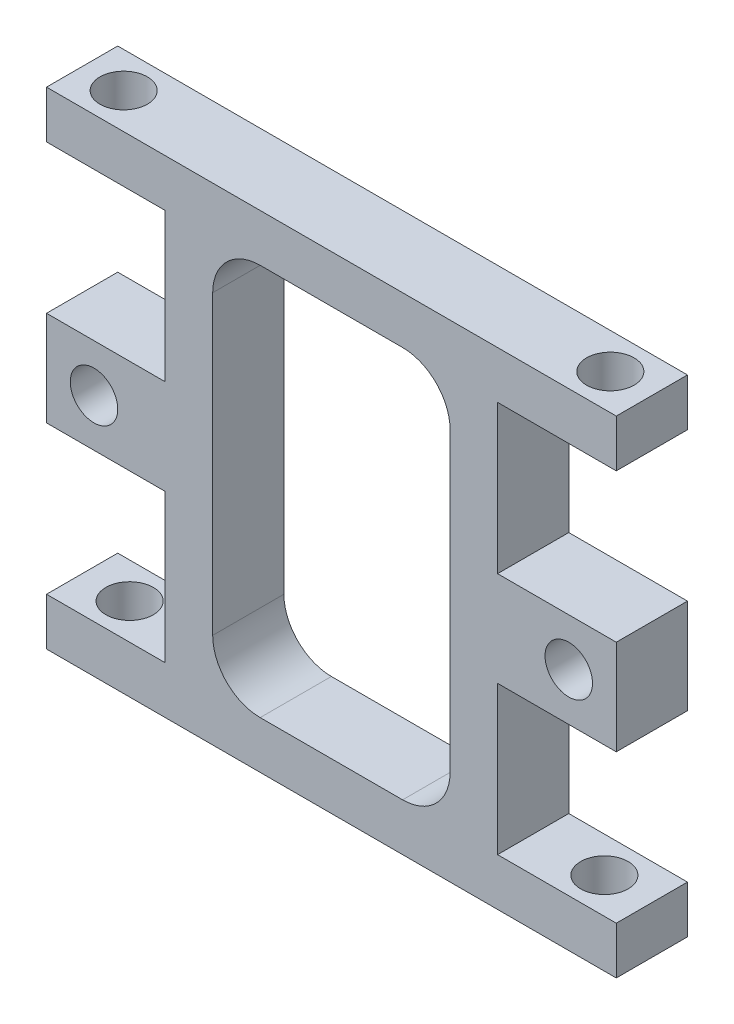
from build123d import *

# Parameters (mm, degrees)
SKETCH2_R           = 3.175
SKETCH2_W           = 31.75
SKETCH2_H           = 52.3875
BOSS_EXTRUDE1_DEPTH = 9.525
FILLET1_R           = 6.35
CUT_EXTRUDE1_REACH  = 78.018
SKETCH3_R           = 3.175
CUT_EXTRUDE2_REACH  = 78.018
SKETCH4_R           = 3.175


with BuildPart() as part:
    # Sketch2 → Boss-Extrude1 (new body)
    with BuildSketch(Plane.XY):
        Polygon((-22.225, -26.19375), (-22.225, -6.35), (-38.1, -6.35), (-38.1, 6.35), (-22.225, 6.35), (-22.225, 26.19375), (-38.1, 26.19375), (-38.1, 32.54375), (38.1, 32.54375), (38.1, 26.19375), (22.225, 26.19375), (22.225, 6.35), (38.1, 6.35), (38.1, -6.35), (22.225, -6.35), (22.225, -26.19375), (38.1, -26.19375), (38.1, -32.54375), (-38.1, -32.54375), (-38.1, -26.19375), align=None)
        with Locations(Location((-31.75, 0, 0), (0, 0, 180))):
            Circle(SKETCH2_R, mode=Mode.SUBTRACT)
        with Locations(Location((31.75, 0, 0), (0, 0, 180))):
            Circle(SKETCH2_R, mode=Mode.SUBTRACT)
        Rectangle(SKETCH2_W, SKETCH2_H, mode=Mode.SUBTRACT)
    extrude(amount=BOSS_EXTRUDE1_DEPTH)

    # Fillet1
    fillet1_edges = [part.edges().sort_by_distance(p)[0] for p in [
        (-15.875, 26.19375, 4.7625),
        (-15.875, -26.19375, 4.7625),
        (15.875, -26.19375, 4.7625),
        (15.875, 26.19375, 4.7625),
    ]]
    fillet(fillet1_edges, radius=FILLET1_R)

    # Sketch3 → Cut-Extrude1 (cut, up to next)
    with BuildSketch(Plane(origin=(0, 32.54375, 0), x_dir=(1, 0, 0), z_dir=(0, 1, 0)), mode=Mode.PRIVATE) as cut_extrude1_sk1:
        with Locations(Location((-32.54375, -4.7625, 0), (0, 0, 270))):
            Circle(SKETCH3_R)
    cut_extrude1_tool1 = extrude(cut_extrude1_sk1.sketch, amount=-CUT_EXTRUDE1_REACH, mode=Mode.PRIVATE) & part.part
    # Sketch3 → Cut-Extrude1 (cut, up to next)
    with BuildSketch(Plane(origin=(0, 32.54375, 0), x_dir=(1, 0, 0), z_dir=(0, 1, 0)), mode=Mode.PRIVATE) as cut_extrude1_sk2:
        with Locations(Location((32.54375, -4.7625, 0), (0, 0, 270))):
            Circle(SKETCH3_R)
    cut_extrude1_tool2 = extrude(cut_extrude1_sk2.sketch, amount=-CUT_EXTRUDE1_REACH, mode=Mode.PRIVATE) & part.part
    add(cut_extrude1_tool1.solids().sort_by_distance((-32.54375, 32.54375, 4.7625))[0], mode=Mode.SUBTRACT)
    add(cut_extrude1_tool2.solids().sort_by_distance((32.54375, 32.54375, 4.7625))[0], mode=Mode.SUBTRACT)

    # Sketch4 → Cut-Extrude2 (cut, up to next)
    with BuildSketch(Plane.XZ.offset(32.54375), mode=Mode.PRIVATE) as cut_extrude2_sk1:
        with Locations(Location((-31.75, 4.7625, 0), (0, 0, 270))):
            Circle(SKETCH4_R)
    cut_extrude2_tool1 = extrude(cut_extrude2_sk1.sketch, amount=-CUT_EXTRUDE2_REACH, mode=Mode.PRIVATE) & part.part
    # Sketch4 → Cut-Extrude2 (cut, up to next)
    with BuildSketch(Plane.XZ.offset(32.54375), mode=Mode.PRIVATE) as cut_extrude2_sk2:
        with Locations(Location((31.75, 4.7625, 0), (0, 0, 270))):
            Circle(SKETCH4_R)
    cut_extrude2_tool2 = extrude(cut_extrude2_sk2.sketch, amount=-CUT_EXTRUDE2_REACH, mode=Mode.PRIVATE) & part.part
    add(cut_extrude2_tool1.solids().sort_by_distance((-31.75, -32.54375, 4.7625))[0], mode=Mode.SUBTRACT)
    add(cut_extrude2_tool2.solids().sort_by_distance((31.75, -32.54375, 4.7625))[0], mode=Mode.SUBTRACT)


solid = part.part
